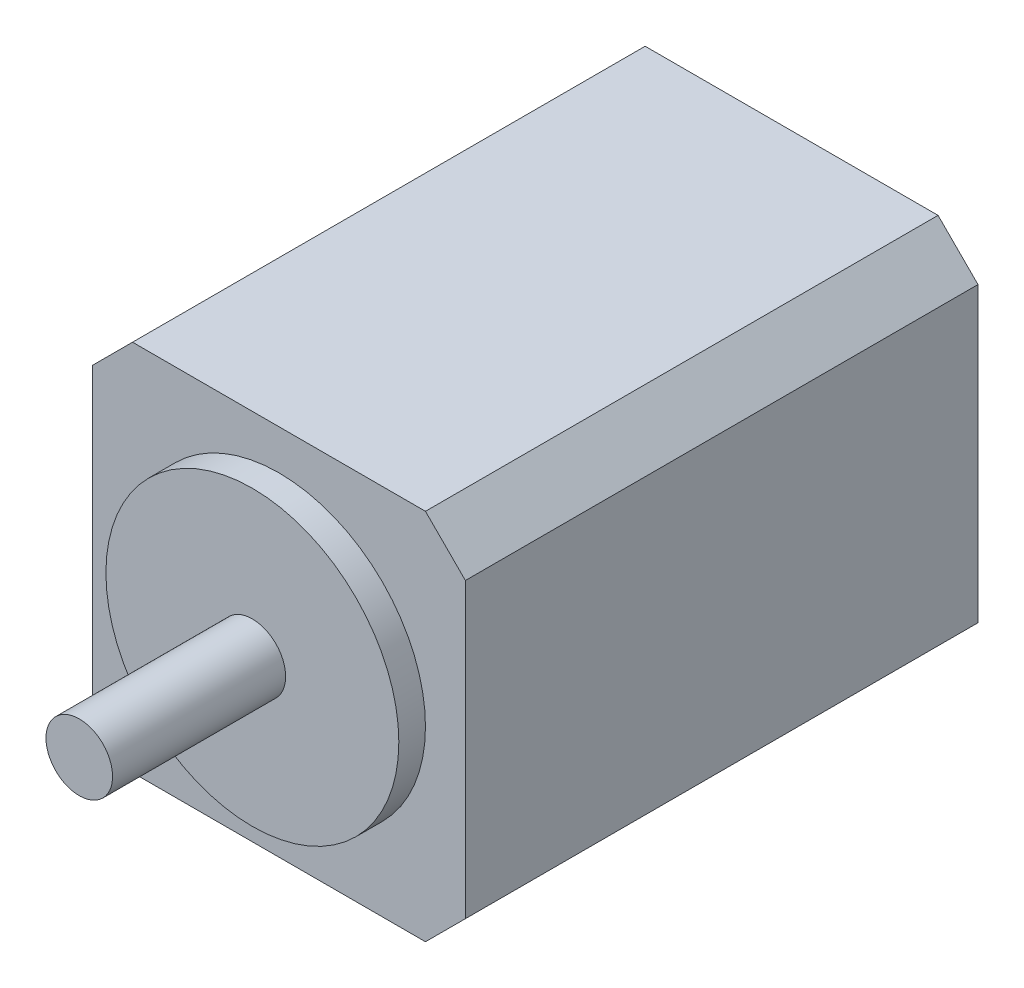
from build123d import *

# Parameters (mm, degrees)
SKETCH_1_W      = 28
SKETCH_1_H      = 28
EXTRUDE_1_DEPTH = 38.5
SKETCH_2_R      = 11
EXTRUDE_2_DEPTH = 2
SKETCH_3_R      = 2.5
EXTRUDE_3_DEPTH = 13
CHAMFER_1_SIZE  = 3


with BuildPart() as part:
    # 草图1 → 凸台-拉伸1 (new body)
    with BuildSketch(Plane.XY):
        Rectangle(SKETCH_1_W, SKETCH_1_H)
    extrude(amount=EXTRUDE_1_DEPTH)

    # 草图2 → 凸台-拉伸2 (add)
    with BuildSketch(Plane.XY.offset(38.5)):
        Circle(SKETCH_2_R)
    extrude(amount=EXTRUDE_2_DEPTH)

    # 草图3 → 凸台-拉伸3 (add)
    with BuildSketch(Plane.XY.offset(40.5)):
        with Locations(Location((0, 0, 0), (0, 0, 180))):
            Circle(SKETCH_3_R)
    extrude(amount=EXTRUDE_3_DEPTH)

    # 倒角1
    chamfer_1_edges = [part.edges().sort_by_distance(p)[0] for p in [
        (14, -14, 19.25),
        (-14, -14, 19.25),
        (-14, 14, 19.25),
        (14, 14, 19.25),
    ]]
    chamfer(chamfer_1_edges, length=CHAMFER_1_SIZE)


solid = part.part
